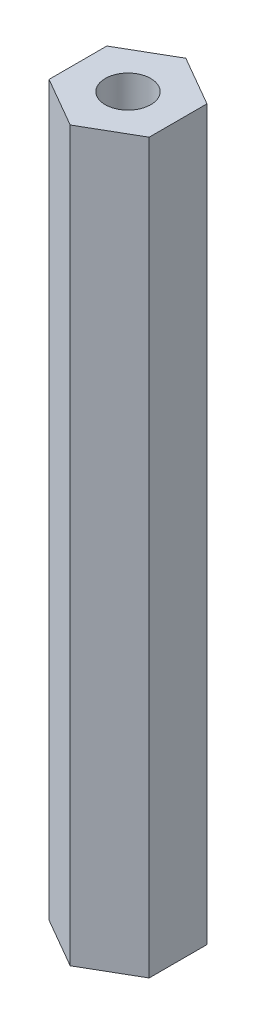
from build123d import *

# Parameters (mm, degrees)
HEX_2_DEPTH             = 40
TAP_DRILL_FOR_M3_TAP1_D = 2.5


with BuildPart() as part:
    # Sketch2 → hex 2 (new body)
    with BuildSketch(Plane(origin=(0, 0, 0), x_dir=(1, 0, 0), z_dir=(0, 1, 0))):
        Polygon((0, 3.175426481), (-2.75, 1.58771324), (-2.75, -1.58771324), (0, -3.175426481), (2.75, -1.58771324), (2.75, 1.58771324), align=None)
    extrude(amount=HEX_2_DEPTH)

    # Tap Drill for M3 Tap1 (through all)
    with Locations(Plane(origin=(0, 0, 0), x_dir=(-1, 0, 0), z_dir=(0, -1, 0))):
        with Locations((0, 0)):
            Hole(TAP_DRILL_FOR_M3_TAP1_D / 2)


solid = part.part
